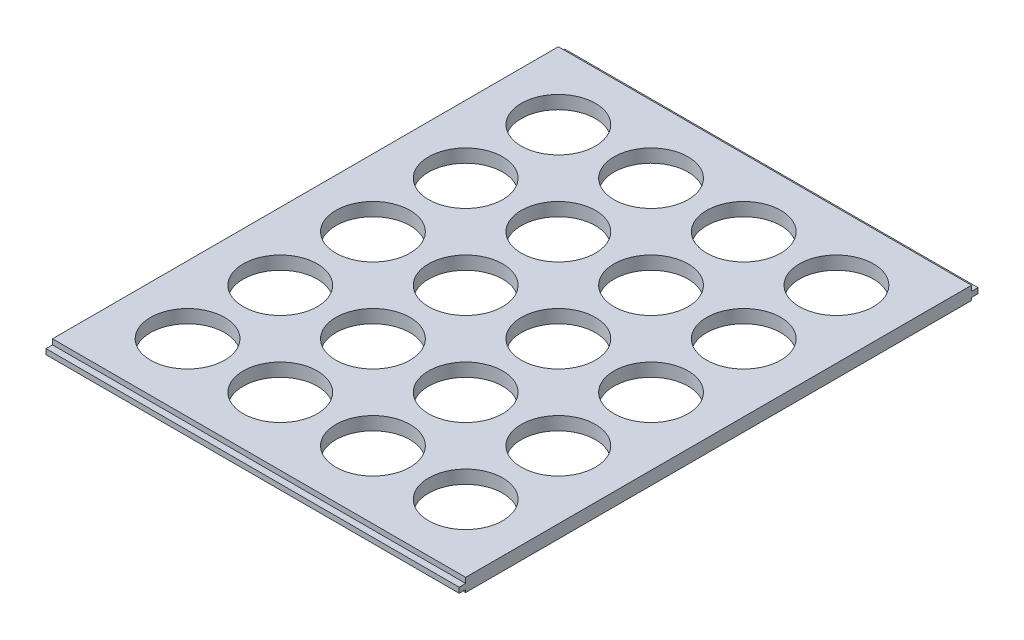
from build123d import *

# Parameters (mm, degrees)
SKETCH1_W           = 156
SKETCH1_H           = 191
SKETCH1_R           = 14
BOSS_EXTRUDE1_DEPTH = 5
SKETCH2_W           = 156
SKETCH2_H           = 2
BOSS_EXTRUDE2_DEPTH = 2.45
SKETCH3_W           = 156
SKETCH3_H           = 2
BOSS_EXTRUDE3_DEPTH = 2.45


with BuildPart() as part:
    # Sketch1 → Boss-Extrude1 (new body)
    with BuildSketch(Plane(origin=(0, 0, 0), x_dir=(1, 0, 0), z_dir=(0, 1, 0))):
        with Locations((78, -95.5)):
            Rectangle(SKETCH1_W, SKETCH1_H)
        with Locations((25.5, -165.5)):
            Circle(SKETCH1_R, mode=Mode.SUBTRACT)
        with Locations((60.5, -165.5)):
            Circle(SKETCH1_R, mode=Mode.SUBTRACT)
        with Locations((95.5, -165.5)):
            Circle(SKETCH1_R, mode=Mode.SUBTRACT)
        with Locations((130.5, -165.5)):
            Circle(SKETCH1_R, mode=Mode.SUBTRACT)
        with Locations((60.5, -130.5)):
            Circle(SKETCH1_R, mode=Mode.SUBTRACT)
        with Locations((95.5, -130.5)):
            Circle(SKETCH1_R, mode=Mode.SUBTRACT)
        with Locations((130.5, -130.5)):
            Circle(SKETCH1_R, mode=Mode.SUBTRACT)
        with Locations((60.5, -95.5)):
            Circle(SKETCH1_R, mode=Mode.SUBTRACT)
        with Locations((95.5, -95.5)):
            Circle(SKETCH1_R, mode=Mode.SUBTRACT)
        with Locations((130.5, -95.5)):
            Circle(SKETCH1_R, mode=Mode.SUBTRACT)
        with Locations((60.5, -60.5)):
            Circle(SKETCH1_R, mode=Mode.SUBTRACT)
        with Locations((95.5, -60.5)):
            Circle(SKETCH1_R, mode=Mode.SUBTRACT)
        with Locations((130.5, -60.5)):
            Circle(SKETCH1_R, mode=Mode.SUBTRACT)
        with Locations((60.5, -25.5)):
            Circle(SKETCH1_R, mode=Mode.SUBTRACT)
        with Locations((95.5, -25.5)):
            Circle(SKETCH1_R, mode=Mode.SUBTRACT)
        with Locations((130.5, -25.5)):
            Circle(SKETCH1_R, mode=Mode.SUBTRACT)
        with Locations((25.5, -130.5)):
            Circle(SKETCH1_R, mode=Mode.SUBTRACT)
        with Locations((25.5, -95.5)):
            Circle(SKETCH1_R, mode=Mode.SUBTRACT)
        with Locations((25.5, -60.5)):
            Circle(SKETCH1_R, mode=Mode.SUBTRACT)
        with Locations((25.5, -25.5)):
            Circle(SKETCH1_R, mode=Mode.SUBTRACT)
    extrude(amount=BOSS_EXTRUDE1_DEPTH)

    # Sketch2 → Boss-Extrude2 (add)
    with BuildSketch(Plane.XY.offset(191)):
        with Locations((78, 2)):
            Rectangle(SKETCH2_W, SKETCH2_H)
    extrude(amount=BOSS_EXTRUDE2_DEPTH)

    # Sketch3 → Boss-Extrude3 (add)
    with BuildSketch(Plane(origin=(0, 0, 0), x_dir=(-1, 0, 0), z_dir=(0, 0, -1))):
        with Locations((-78, 2)):
            Rectangle(SKETCH3_W, SKETCH3_H)
    extrude(amount=BOSS_EXTRUDE3_DEPTH)


solid = part.part
